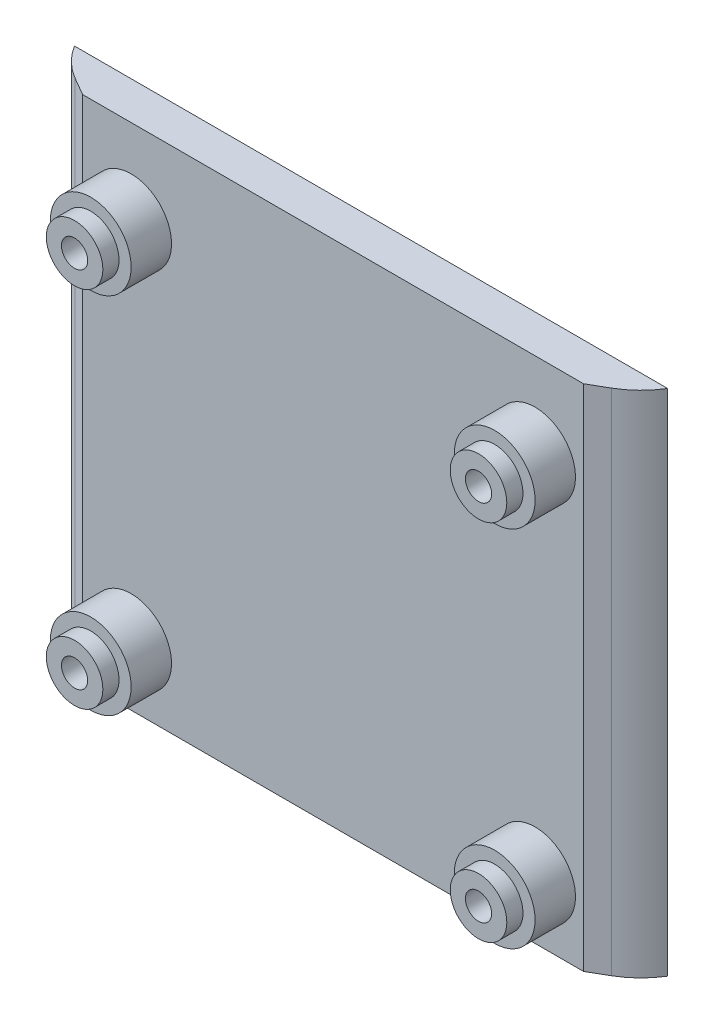
from build123d import *

# Parameters (mm, degrees)
ESQUISSE1_W                  = 62
ESQUISSE1_H                  = 60
BOSS_EXTRU_1_DEPTH           = 10
ESQUISSE3_R                  = 5
BOSS_EXTRU_2_DEPTH           = 5
ESQUISSE4_R                  = 3.5
BOSS_EXTRU_3_DEPTH           = 2
ESQUISSE5_R                  = 1.625
ENL_V_MAT_EXTRU_2_DEPTH      = 88.93747779
BOSS_EXTRU_4_DEPTH           = 3
ESQUISSE9_R                  = 11
ESQUISSE9_R_2                = 1.625
ESQUISSE9_R_3                = 1.5
ENL_V_MAT_EXTRU_4_DEPTH      = 10
BOSS_EXTRU_6_DEPTH           = 63
ENL_V_MAT_EXTRU_6_DEPTH      = 4
ENL_V_MAT_EXTRU_7_DEPTH      = 102
ENL_V_MAT_EXTRU_8_DEPTH      = 23
ENL_V_MAT_EXTRU_8_DEPTH_BACK = 1
ESQUISSE19_W                 = 42
ESQUISSE19_H                 = 42
CHANFREIN1_SIZE              = 1
CONG_1_R                     = 10
ESQUISSE20_W                 = 96.792413771
ESQUISSE20_H                 = 78.280203487
ENL_V_MAT_EXTRU_10_DEPTH     = 107.575890285


with BuildPart() as part:
    # Esquisse1 → Boss.-Extru.1 (new body)
    with BuildSketch(Plane.XY):
        with Locations((31, 30)):
            Rectangle(ESQUISSE1_W, ESQUISSE1_H)
    extrude(amount=BOSS_EXTRU_1_DEPTH)

    # Esquisse3 → Boss.-Extru.2 (add)
    with BuildSketch(Plane.XY.offset(10)):
        with Locations(Location((6, 52.5, 0), (0, 0, 180))):
            Circle(ESQUISSE3_R)
        with Locations(Location((56, 7.5, 0), (0, 0, 180))):
            Circle(ESQUISSE3_R)
        with Locations(Location((6, 7.5, 0), (0, 0, 180))):
            Circle(ESQUISSE3_R)
        with Locations(Location((56, 52.5, 0), (0, 0, 180))):
            Circle(ESQUISSE3_R)
    extrude(amount=BOSS_EXTRU_2_DEPTH)

    # Esquisse4 → Boss.-Extru.3 (add)
    with BuildSketch(Plane.XY.offset(15)):
        with Locations((6, 52.5)):
            Circle(ESQUISSE4_R)
        with Locations((56, 52.5)):
            Circle(ESQUISSE4_R)
        with Locations((56, 7.5)):
            Circle(ESQUISSE4_R)
        with Locations((6, 7.5)):
            Circle(ESQUISSE4_R)
    extrude(amount=BOSS_EXTRU_3_DEPTH)

    # Esquisse5 → Enlèv. mat.-Extru.2 (cut, through all)
    with BuildSketch(Plane.XY.offset(17)):
        with Locations((6, 52.5)):
            Circle(ESQUISSE5_R)
        with Locations((56, 52.5)):
            Circle(ESQUISSE5_R)
        with Locations((56, 7.5)):
            Circle(ESQUISSE5_R)
        with Locations((6, 7.5)):
            Circle(ESQUISSE5_R)
    extrude(amount=-ENL_V_MAT_EXTRU_2_DEPTH, mode=Mode.SUBTRACT)

    # Esquisse7 → Boss.-Extru.4 (add, symmetric)
    with BuildSketch(Plane(origin=(0, 60, 0), x_dir=(1, 0, 0), z_dir=(0, 1, 0))):
        with BuildLine():
            Line((0, 0), (0, -10))
            Line((0, -10), (62, -10))
            Line((62, -10), (62, 0))
            ThreePointArc((62, 0), (61.543258885, 25.799206928), (56, 51))
            Line((56, 51), (6, 51))
            ThreePointArc((6, 51), (0.456741115, 25.799206928), (0, 0))
        make_face()
    extrude(amount=BOSS_EXTRU_4_DEPTH, both=True)

    # Esquisse9 → Enlèv. mat.-Extru.4 (cut)
    with BuildSketch(Plane(origin=(0, 63, 0), x_dir=(1, 0, 0), z_dir=(0, 1, 0))):
        with Locations(Location((31, 30, 0), (0, 0, 270))):
            Circle(ESQUISSE9_R)
        with Locations(Location((46.5, 14.5, 0), (0, 0, 270))):
            Circle(ESQUISSE9_R_2)
        with Locations(Location((15.5, 14.5, 0), (0, 0, 270))):
            Circle(ESQUISSE9_R_2)
        with Locations(Location((15.5, 45.5, 0), (0, 0, 270))):
            Circle(ESQUISSE9_R_2)
        with Locations(Location((46.5, 45.5, 0), (0, 0, 270))):
            Circle(ESQUISSE9_R_2)
        with Locations(Location((56, 18, 0), (0, 0, 270))):
            Circle(ESQUISSE9_R_3)
        with Locations(Location((6, 18, 0), (0, 0, 270))):
            Circle(ESQUISSE9_R_3)
    extrude(amount=-ENL_V_MAT_EXTRU_4_DEPTH, mode=Mode.SUBTRACT)

    # Esquisse14 → Boss.-Extru.6 (add)
    with BuildSketch(Plane(origin=(0, 63, 0), x_dir=(1, 0, 0), z_dir=(0, 1, 0))):
        with BuildLine():
            Line((0, 0), (0, -10))
            Line((0, -10), (-6.92820323, -6))
            ThreePointArc((-6.92820323, -6), (-4.721429116, 23.465606932), (6, 51))
            Line((6, 51), (11.044473074, 51))
            ThreePointArc((11.044473074, 51), (2.937001082, 26.059854184), (0, 0))
        make_face()
    boss_extru_6 = extrude(amount=-BOSS_EXTRU_6_DEPTH)

    # Symétrie1: Boss.-Extru.6 across plane
    add(boss_extru_6.mirror(Plane(origin=(31, 0, 0), x_dir=(0, 0, 1), z_dir=(1, 0, 0))))

    # Esquisse16 → Enlèv. mat.-Extru.6 (cut)
    with BuildSketch(Plane.XZ.offset(-57)):
        Polygon((10.041451884, -18), (8.020725942, -14.5), (3.979274058, -14.5), (1.958548116, -18), (3.979274058, -21.5), (8.020725942, -21.5), align=None)
        Polygon((60.041451884, -18), (58.020725942, -14.5), (53.979274058, -14.5), (51.958548116, -18), (53.979274058, -21.5), (58.020725942, -21.5), align=None)
    extrude(amount=-ENL_V_MAT_EXTRU_6_DEPTH, mode=Mode.SUBTRACT)

    # Esquisse18 → Enlèv. mat.-Extru.7 (cut, symmetric)
    with BuildSketch(Plane(origin=(0, 0, 0), x_dir=(0, 0, -1), z_dir=(1, 0, 0))):
        with BuildLine():
            Line((51, 53), (51, 0))
            Line((51, 0), (0, 0))
            ThreePointArc((0, 0), (17.977874458, 33.738271748), (51, 53))
        make_face()
    extrude(amount=ENL_V_MAT_EXTRU_7_DEPTH, both=True, mode=Mode.SUBTRACT)

    # Esquisse19 → Enlèv. mat.-Extru.8 (cut, two sides: drawn at the far end of the back side and taken through both)
    with BuildSketch(Plane.XZ.offset(-57).offset(-ENL_V_MAT_EXTRU_8_DEPTH_BACK)):
        with Locations((31, -30)):
            Rectangle(ESQUISSE19_W, ESQUISSE19_H)
    extrude(amount=ENL_V_MAT_EXTRU_8_DEPTH + ENL_V_MAT_EXTRU_8_DEPTH_BACK, mode=Mode.SUBTRACT)

    # Chanfrein1
    chanfrein1_edges = [part.edges().sort_by_distance(p)[0] for p in [
        (31, 63, -41),
    ]]
    chamfer(chanfrein1_edges, length=CHANFREIN1_SIZE)

    # Congé1
    cong_1_edges = [part.edges().sort_by_distance(p)[0] for p in [
        (-6.92820323, 31.5, 6),
        (68.92820323, 31.5, 6),
    ]]
    fillet(cong_1_edges, radius=CONG_1_R)

    # Esquisse20 → Enlèv. mat.-Extru.10 (cut, through all)
    with BuildSketch(Plane(origin=(0, 63, 0), x_dir=(1, 0, 0), z_dir=(0, 1, 0))):
        with Locations((33.820908233, 33.83729602)):
            Rectangle(ESQUISSE20_W, ESQUISSE20_H)
    extrude(amount=-ENL_V_MAT_EXTRU_10_DEPTH, mode=Mode.SUBTRACT)


solid = part.part
